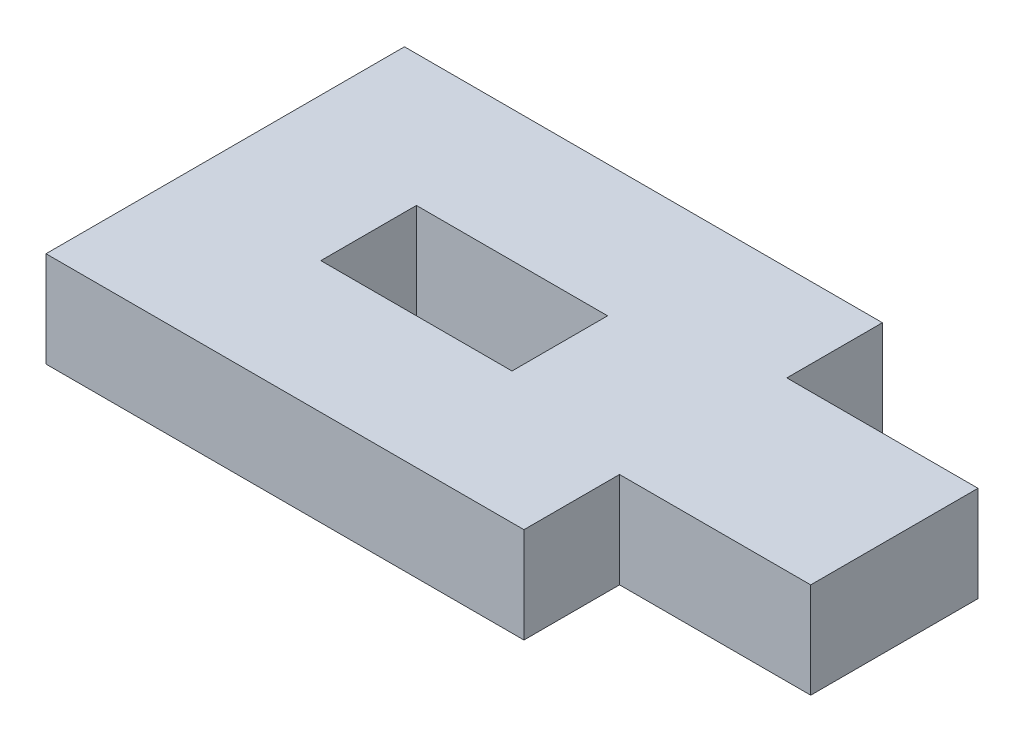
from build123d import *

# Parameters (mm, degrees)
SKETCH1_W           = 20
SKETCH1_H           = 15
SKETCH1_W_2         = 8
SKETCH1_H_2         = 4
BOSS_EXTRUDE1_DEPTH = 4
SKETCH2_W           = 8
SKETCH2_H           = 7
BOSS_EXTRUDE3_DEPTH = 4


with BuildPart() as part:
    # Sketch1 → Boss-Extrude1 (new body)
    with BuildSketch(Plane(origin=(0, 0, 0), x_dir=(1, 0, 0), z_dir=(0, 1, 0))):
        Rectangle(SKETCH1_W, SKETCH1_H)
        Rectangle(SKETCH1_W_2, SKETCH1_H_2, mode=Mode.SUBTRACT)
    extrude(amount=BOSS_EXTRUDE1_DEPTH)

    # Sketch2 → Boss-Extrude3 (add)
    with BuildSketch(Plane(origin=(0, 0, 0), x_dir=(1, 0, 0), z_dir=(0, 1, 0))):
        with Locations((14, 0)):
            Rectangle(SKETCH2_W, SKETCH2_H)
    extrude(amount=BOSS_EXTRUDE3_DEPTH)


solid = part.part
